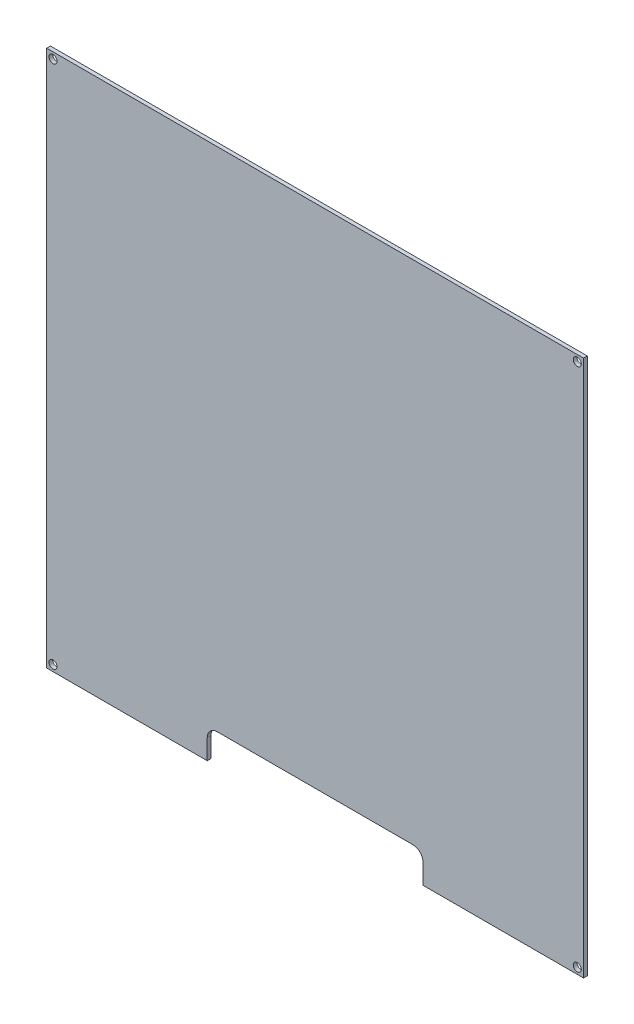
from build123d import *

# Parameters (mm, degrees)
SKETCH1_W           = 214
SKETCH1_H           = 214
SKETCH1_R           = 1.6
BOSS_EXTRUDE1_DEPTH = 1.5
SKETCH2_W           = 86
SKETCH2_H           = 12
CUT_EXTRUDE1_DEPTH  = 152.328285525
FILLET1_R           = 4


with BuildPart() as part:
    # Sketch1 → Boss-Extrude1 (new body)
    with BuildSketch(Plane.XY):
        Rectangle(SKETCH1_W, SKETCH1_H)
        with Locations((-104.5, 104.5)):
            Circle(SKETCH1_R, mode=Mode.SUBTRACT)
        with Locations((104.5, 104.5)):
            Circle(SKETCH1_R, mode=Mode.SUBTRACT)
        with Locations((0, -104.5)):
            Circle(SKETCH1_R, mode=Mode.SUBTRACT)
        with Locations(Location((104.5, -104.5, 0), (0, 0, 180))):
            Circle(SKETCH1_R, mode=Mode.SUBTRACT)
        with Locations(Location((-104.5, -104.5, 0), (0, 0, 180))):
            Circle(SKETCH1_R, mode=Mode.SUBTRACT)
    extrude(amount=BOSS_EXTRUDE1_DEPTH)

    # Sketch2 → Cut-Extrude1 (cut, through all)
    with BuildSketch(Plane.XY.offset(1.5)):
        with Locations((0, -101)):
            Rectangle(SKETCH2_W, SKETCH2_H)
    extrude(amount=-CUT_EXTRUDE1_DEPTH, mode=Mode.SUBTRACT)

    # Fillet1
    fillet1_edges = [part.edges().sort_by_distance(p)[0] for p in [
        (-43, -95, 0.75),
        (43, -95, 0.75),
    ]]
    fillet(fillet1_edges, radius=FILLET1_R)


solid = part.part
